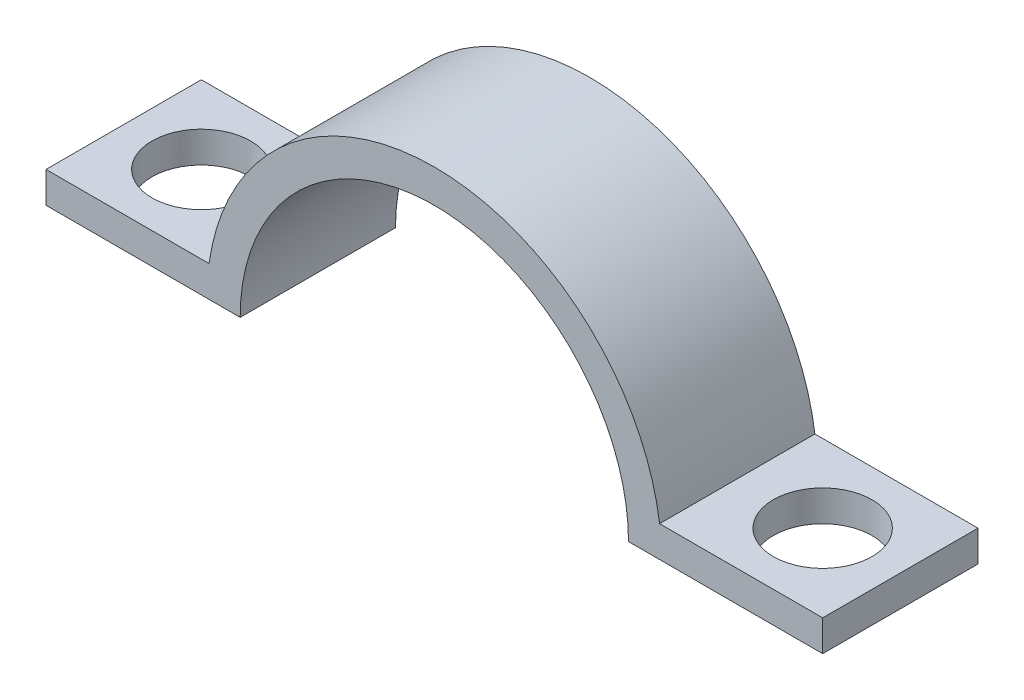
from build123d import *

# Parameters (mm, degrees)
BOSS_EXTRUDE1_DEPTH = 40
SKETCH2_R           = 12.7
CUT_EXTRUDE2_DEPTH  = 40


with BuildPart() as part:
    # Sketch1 → Boss-Extrude1 (new body)
    with BuildSketch(Plane.XY):
        with BuildLine():
            Line((133.254134777, 0), (133.254134777, 8))
            Line((133.254134777, 8), (91.254134777, 8))
            ThreePointArc((91.254134777, 8), (33.254134777, 58.549124673), (-24.745865223, 8))
            Line((-24.745865223, 8), (-66.745865223, 8))
            Line((-66.745865223, 8), (-66.745865223, 0))
            Line((-66.745865223, 0), (-16.745865223, 0))
            ThreePointArc((-16.745865223, 0), (33.254134777, 50), (83.254134777, 0))
            Line((83.254134777, 0), (133.254134777, 0))
        make_face()
    extrude(amount=BOSS_EXTRUDE1_DEPTH)

    # Sketch2 → Cut-Extrude2 (cut)
    with BuildSketch(Plane(origin=(0, 8, 0), x_dir=(1, 0, 0), z_dir=(0, 1, 0))):
        with Locations(Location((-46.745865223, -20, 0), (0, 0, 180))):
            Circle(SKETCH2_R)
        with Locations(Location((113.254134777, -20, 0), (0, 0, 180))):
            Circle(SKETCH2_R)
    extrude(amount=-CUT_EXTRUDE2_DEPTH, mode=Mode.SUBTRACT)


solid = part.part
